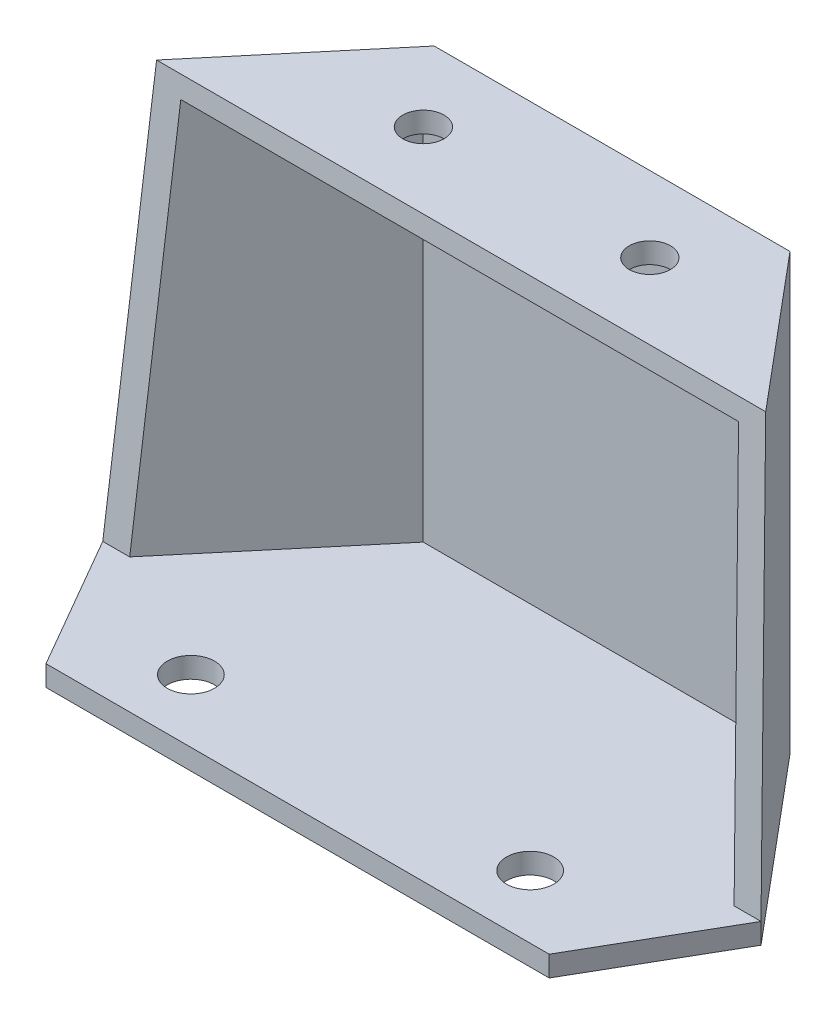
from build123d import *

# Parameters (mm, degrees)
EXTRUDE_1_DEPTH          = 211
SHELL_1_T                = 10
CUT_EXTRUDE_1_DEPTH      = 306.363666708
CUT_EXTRUDE_1_DEPTH_BACK = 306.363666708
CUT_EXTRUDE_2_DEPTH      = 306.363666708
CUT_EXTRUDE_2_DEPTH_BACK = 40
SKETCH_3_R               = 10
SKETCH_4_R               = 11.451002367
CUT_EXTRUDE_3_DEPTH      = 40


with BuildPart() as part:
    # 草图1 → 凸台-拉伸1 (new body)
    with BuildSketch(Plane(origin=(0, 0, 0), x_dir=(1, 0, 0), z_dir=(0, 1, 0))):
        Polygon((122, 0), (-122, 0), (-159.592352403, 65.111864338), (-86.265, 152.5), (86.265, 152.5), (159.592352403, 65.111864338), align=None)
    extrude(amount=EXTRUDE_1_DEPTH)

    # 抽壳1 (no face opened: a closed hollow body)
    add(offset(amount=-SHELL_1_T, mode=Mode.PRIVATE), mode=Mode.SUBTRACT)

    # 草图2 → 切除-拉伸1 (cut, two sides: drawn at the far end of the back side and taken through both)
    with BuildSketch(Plane(origin=(0, 0, 0), x_dir=(0, 0, -1), z_dir=(1, 0, 0)).offset(-CUT_EXTRUDE_1_DEPTH_BACK)):
        Polygon((79.3, 211), (65.111864338, 10), (0, 10), (0, 211), align=None)
    extrude(amount=CUT_EXTRUDE_1_DEPTH + CUT_EXTRUDE_1_DEPTH_BACK, mode=Mode.SUBTRACT)

    # 草图3 → 切除-拉伸2 (cut, two sides: drawn at the far end of the back side and taken through both)
    with BuildSketch(Plane(origin=(0, 211, 0), x_dir=(1, 0, 0), z_dir=(0, 1, 0)).offset(-CUT_EXTRUDE_2_DEPTH_BACK)):
        with Locations(Location((-54.9, 115.9, 0), (0, 0, 90))):
            Circle(SKETCH_3_R)
        with Locations(Location((54.9, 115.9, 0), (0, 0, 90))):
            Circle(SKETCH_3_R)
    extrude(amount=CUT_EXTRUDE_2_DEPTH + CUT_EXTRUDE_2_DEPTH_BACK, mode=Mode.SUBTRACT)

    # 草图4 → 切除-拉伸3 (cut)
    with BuildSketch(Plane(origin=(0, 10, 0), x_dir=(1, 0, 0), z_dir=(0, 1, 0))):
        with Locations(Location((-82.25, 30.5, 0), (0, 0, 270))):
            Circle(SKETCH_4_R)
        with Locations(Location((82.25, 30.5, 0), (0, 0, 270))):
            Circle(SKETCH_4_R)
    extrude(amount=-CUT_EXTRUDE_3_DEPTH, mode=Mode.SUBTRACT)


solid = part.part
